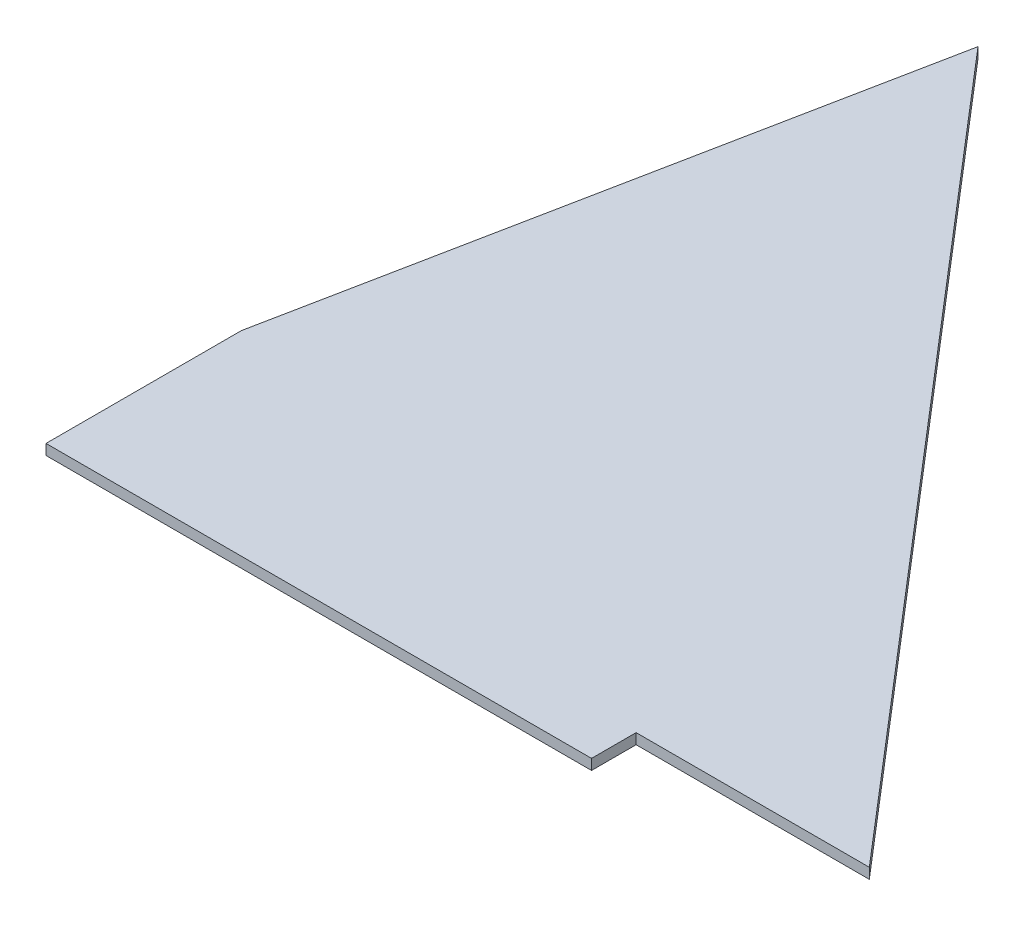
from build123d import *

# Parameters (mm, degrees)
EXTRUDE_1_DEPTH = 1
EXTRUDE_2_DEPTH = 1


with BuildPart() as part:
    # 草图1 → 凸台-拉伸1 (new body)
    with BuildSketch(Plane(origin=(0, 0, 0), x_dir=(1, 0, 0), z_dir=(0, 1, 0))):
        Polygon((12.66597943, 73.92266442), (1, 15.376339461), (1, -3.25), (53, -3.25), (53, 1), (75.227111726, 1), align=None)
    extrude(amount=EXTRUDE_1_DEPTH)

    # 草图2 → 凸台-拉伸2 (add)
    # profile 1 of 2: a face of its own
    with BuildSketch(Plane(origin=(0, 0, 0), x_dir=(1, 0, 0), z_dir=(0, 1, 0))):
        with BuildLine():
            Line((31.090740008, 15.394221889), (30.323543176, 15.394221889))
            Line((30.323543176, 15.394221889), (30.323543176, 17.352620355))
            add(Edge.make_bspline(
                [(30.323543176, 17.352620355), (30.291480188, 17.346927632), (30.225432017, 17.335200902), (30.122464474, 17.325658206), (30.013401991, 17.319675849), (29.938694803, 17.319783871), (29.900262675, 17.319839442)],
                knots=[0, 0, 0, 0, 0.918585764, 1.892241272, 2.915691322, 4, 4, 4, 4], degree=3))
            add(Edge.make_bspline(
                [(29.900262675, 17.319839442), (29.841962947, 17.319869767), (29.726722993, 17.319929711), (29.556261285, 17.335932691), (29.390055361, 17.361937179), (29.228423578, 17.400915644), (29.070924954, 17.451283461), (28.917434146, 17.512464376), (28.768763104, 17.586671732), (28.62561681, 17.671704257), (28.490911455, 17.769835394), (28.373499458, 17.887220571), (28.271718538, 18.019975809), (28.188806413, 18.170044776), (28.12115622, 18.335792286), (28.072018776, 18.517995324), (28.038306105, 18.716089526), (28.030646768, 18.853776873), (28.026679563, 18.925092951)],
                knots=[0, 0, 0, 0, 1.003522523, 1.98364375, 2.944869411, 3.898614004, 4.843729631, 5.790462383, 6.741287792, 7.702146141, 8.655643954, 9.602935836, 10.551034771, 11.527201242, 12.5464735, 13.626777097, 14.770773406, 16, 16, 16, 16], degree=3))
            add(Edge.make_bspline(
                [(28.026679563, 18.925092951), (28.029126999, 18.981235603), (28.033891792, 19.09053695), (28.057781565, 19.249075834), (28.094861108, 19.397722477), (28.143989367, 19.537154386), (28.209760487, 19.66561534), (28.285926292, 19.785665607), (28.377011339, 19.895385017), (28.447566531, 19.958919299), (28.483028853, 19.990852784)],
                knots=[0, 0, 0, 0, 1.126595518, 2.193312949, 3.209115705, 4.196248007, 5.151139266, 6.097382339, 7.043709754, 8, 8, 8, 8], degree=3))
            add(Edge.make_bspline(
                [(28.483028853, 19.990852784), (28.522929015, 20.023049122), (28.603984669, 20.088454754), (28.741989665, 20.169383539), (28.893542525, 20.238034743), (29.059185588, 20.295093718), (29.239564674, 20.338290061), (29.434352813, 20.367230207), (29.64317297, 20.387190847), (29.787147929, 20.388758207), (29.861524951, 20.3895679)],
                knots=[0, 0, 0, 0, 0.838628006, 1.70364077, 2.610636308, 3.559859354, 4.568055018, 5.643200099, 6.782484425, 8, 8, 8, 8], degree=3))
            add(Edge.make_bspline(
                [(29.861524951, 20.3895679), (29.924201068, 20.388442465), (30.046421709, 20.386247828), (30.224716607, 20.380809359), (30.393254737, 20.372443419), (30.551968816, 20.360836156), (30.701043327, 20.348103258), (30.840301091, 20.33201309), (30.969478734, 20.313349379), (31.052038447, 20.298457491), (31.091683908, 20.291306355)],
                knots=[0, 0, 0, 0, 1.217605855, 2.374374404, 3.464660226, 4.494999595, 5.465333604, 6.370582827, 7.217548217, 8, 8, 8, 8], degree=3))
            Line((31.091683908, 20.291306355), (31.090740008, 15.394221889))
        make_face()
        with BuildLine():
            add(Edge.make_bspline(
                [(30.323543176, 19.750609507), (30.294001104, 19.756441871), (30.227115227, 19.76964686), (30.11276139, 19.781736761), (29.973146382, 19.790998313), (29.871306917, 19.79377259), (29.816173468, 19.795274517)],
                knots=[0, 0, 0, 0, 0.708180311, 1.603383121, 2.702528978, 4, 4, 4, 4], degree=3))
            add(Edge.make_bspline(
                [(29.816173468, 19.795274517), (29.778674753, 19.794489016), (29.705419893, 19.792954518), (29.598288212, 19.782736487), (29.496988537, 19.764581207), (29.401019543, 19.740409824), (29.311269908, 19.708215699), (29.227058284, 19.669148461), (29.148784868, 19.623070355), (29.076655109, 19.569835898), (29.010798742, 19.510512464), (28.953667436, 19.442775826), (28.905730333, 19.367849012), (28.86536387, 19.286573026), (28.83427513, 19.198006126), (28.811939273, 19.102330333), (28.797510474, 18.999843052), (28.79510899, 18.929236118), (28.793875472, 18.892968984)],
                knots=[0, 0, 0, 0, 1.164286524, 2.274468469, 3.33712435, 4.356941393, 5.343590938, 6.292901648, 7.23538906, 8.158502959, 9.072142365, 9.981112688, 10.900594105, 11.827687296, 12.792632354, 13.80775062, 14.873954761, 16, 16, 16, 16], degree=3))
            add(Edge.make_bspline(
                [(28.793875472, 18.892968984), (28.795134881, 18.854191832), (28.797580351, 18.778895935), (28.811554204, 18.669650618), (28.835574304, 18.567590725), (28.867328792, 18.472146789), (28.907923347, 18.383372416), (28.95859169, 18.302223365), (29.018603775, 18.228366562), (29.086740761, 18.16077878), (29.163691225, 18.101659974), (29.247154269, 18.048964292), (29.338736059, 18.005658508), (29.437186031, 17.969976467), (29.54264825, 17.941254338), (29.655625397, 17.922037488), (29.775583455, 17.909511306), (29.858027897, 17.907569166), (29.900262675, 17.906574244)],
                knots=[0, 0, 0, 0, 1.10647952, 2.148516939, 3.135813804, 4.093347323, 5.013956832, 5.913991464, 6.814877829, 7.723438285, 8.645449828, 9.577866136, 10.534345172, 11.529217628, 12.562346088, 13.648092354, 14.795160789, 16, 16, 16, 16], degree=3))
            add(Edge.make_bspline(
                [(29.900262675, 17.906574244), (29.941533493, 17.906028809), (30.020359402, 17.904987046), (30.132306289, 17.911998092), (30.23270458, 17.922996362), (30.294355499, 17.937500422), (30.323543176, 17.944367146)],
                knots=[0, 0, 0, 0, 1.161518353, 2.218461969, 3.156558288, 4, 4, 4, 4], degree=3))
            Line((30.323543176, 17.944367146), (30.323543176, 19.750609507))
        make_face(mode=Mode.SUBTRACT)
    # profile 2 of 2: a face of its own
    with BuildSketch(Plane(origin=(0, 0, 0), x_dir=(1, 0, 0), z_dir=(0, 1, 0))):
        with BuildLine():
            Line((32.077134748, 20.358527157), (32.844331579, 20.358527157))
            Line((32.844331579, 20.358527157), (32.844331579, 17.334805283))
            add(Edge.make_bspline(
                [(32.844331579, 17.334805283), (32.846041524, 17.274995945), (32.849340681, 17.159600138), (32.862116571, 16.992717533), (32.883577596, 16.838338831), (32.913517977, 16.696138778), (32.951987807, 16.566089797), (32.999008574, 16.448639235), (33.054117718, 16.34331339), (33.117299737, 16.250152646), (33.189122104, 16.169354435), (33.266600201, 16.098618835), (33.351533105, 16.040070587), (33.442049228, 15.99081552), (33.539783431, 15.954258392), (33.643837974, 15.928897808), (33.754040259, 15.91342912), (33.829727782, 15.911895168), (33.868517376, 15.911109023)],
                knots=[0, 0, 0, 0, 1.442558911, 2.783265207, 4.033293762, 5.19797452, 6.283894868, 7.299176403, 8.243481286, 9.144954945, 10.005756174, 10.844503658, 11.66816234, 12.486940923, 13.323278702, 14.176003432, 15.065208066, 16, 16, 16, 16], degree=3))
            add(Edge.make_bspline(
                [(33.868517376, 15.911109023), (33.904473646, 15.911526383), (33.97484436, 15.912343207), (34.077658287, 15.92781335), (34.174878032, 15.954543092), (34.267116792, 15.991646317), (34.354322253, 16.038718034), (34.435688698, 16.097382655), (34.511493017, 16.167040691), (34.582608735, 16.247198802), (34.646508679, 16.340053843), (34.701762221, 16.445170296), (34.749598601, 16.562786913), (34.787162737, 16.693178193), (34.818776759, 16.835728654), (34.84076289, 16.990817804), (34.855116558, 17.158326046), (34.857473172, 17.274141756), (34.858691406, 17.33401178)],
                knots=[0, 0, 0, 0, 0.880869997, 1.723967724, 2.54076827, 3.348096003, 4.15667844, 4.964596865, 5.80091263, 6.676282017, 7.586647838, 8.557371955, 9.582678263, 10.694376867, 11.880403812, 13.160330013, 14.532054847, 16, 16, 16, 16], degree=3))
            Line((34.858691406, 17.33401178), (34.858691406, 20.358527157))
            Line((34.858691406, 20.358527157), (35.625888237, 20.358527157))
            Line((35.625888237, 20.358527157), (35.625888237, 17.380520301))
            add(Edge.make_bspline(
                [(35.625888237, 17.380520301), (35.623936714, 17.291573771), (35.620165761, 17.119701207), (35.595302232, 16.872154063), (35.557140127, 16.644043754), (35.504575812, 16.435278366), (35.438009439, 16.245400882), (35.356778606, 16.074929633), (35.261228593, 15.923975043), (35.150246411, 15.793333485), (35.02731822, 15.680891375), (34.895571803, 15.582265655), (34.752268142, 15.501033739), (34.599951136, 15.43349429), (34.437335243, 15.382310688), (34.264956857, 15.348185822), (34.083249013, 15.326302213), (33.958656361, 15.325651598), (33.894972407, 15.325319044)],
                knots=[0, 0, 0, 0, 1.389947096, 2.68581329, 3.884176986, 5.001519278, 6.046082896, 7.023506491, 7.946473535, 8.830015835, 9.69383004, 10.545329235, 11.396344648, 12.262399475, 13.145009074, 14.054291982, 15.00547603, 16, 16, 16, 16], degree=3))
            add(Edge.make_bspline(
                [(33.894972407, 15.325319044), (33.828469528, 15.326101711), (33.698576147, 15.327630415), (33.508729563, 15.348474132), (33.329189291, 15.385576465), (33.159391405, 15.436827956), (33.000035358, 15.505949179), (32.850490052, 15.58964615), (32.711713219, 15.690227791), (32.581893571, 15.804556755), (32.464864256, 15.937598686), (32.363164513, 16.09050188), (32.277381449, 16.262754247), (32.206934074, 16.45360011), (32.151146625, 16.663013971), (32.111664078, 16.891642935), (32.084450881, 17.139060264), (32.080248305, 17.310628986), (32.078078648, 17.399204536)],
                knots=[0, 0, 0, 0, 1.013962662, 1.980471211, 2.907472823, 3.806985122, 4.680561309, 5.551651082, 6.415505808, 7.289926821, 8.185106327, 9.109702809, 10.082849364, 11.113391155, 12.207519227, 13.383461846, 14.649163417, 16, 16, 16, 16], degree=3))
            Line((32.078078648, 17.399204536), (32.077134748, 20.358527157))
        make_face()
    extrude(amount=-EXTRUDE_2_DEPTH)


solid = part.part
